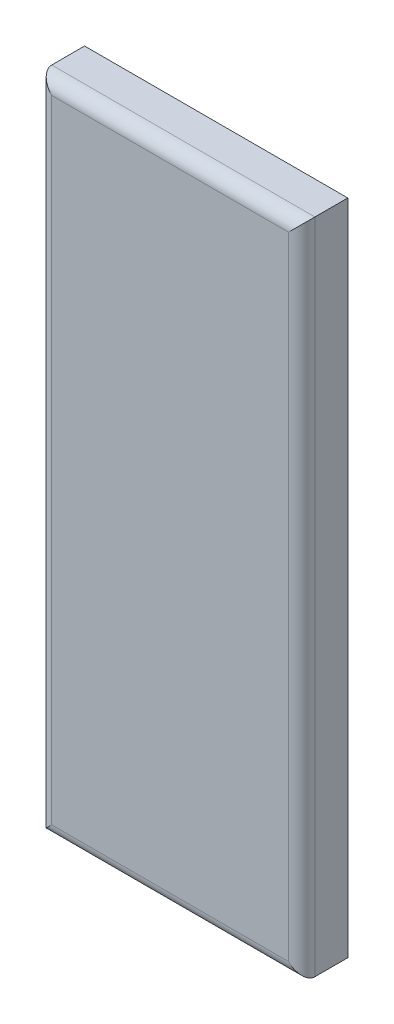
from build123d import *

# Parameters (mm, degrees)
SKETCH1_W           = 40
SKETCH1_H           = 100
BOSS_EXTRUDE1_DEPTH = 7
FILLET1_R           = 2


with BuildPart() as part:
    # Sketch1 → Boss-Extrude1 (new body)
    with BuildSketch(Plane.XY):
        Rectangle(SKETCH1_W, SKETCH1_H)
    extrude(amount=BOSS_EXTRUDE1_DEPTH)

    # Fillet1
    fillet1_edges = [part.edges().sort_by_distance(p)[0] for p in [
        (-20, 0, 7),
        (0, -50, 7),
        (20, 0, 7),
        (0, 50, 7),
    ]]
    fillet(fillet1_edges, radius=FILLET1_R)


solid = part.part
